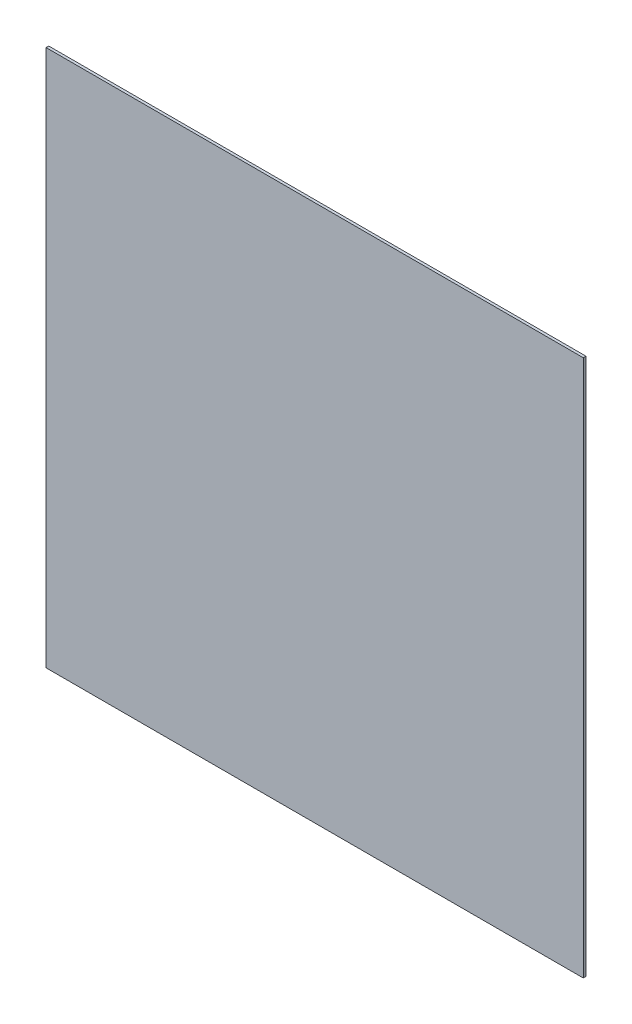
from build123d import *

# Parameters (mm, degrees)
KUTU_KAPAK_320X320_DIK_1_START = -320
SKETCH1_W                      = 320
SKETCH1_H                      = 320
KUTU_KAPAK_320X320_DIK_1_DEPTH = 1.6


with BuildPart() as part:
    # Sketch1 → KUTU_kapak_320x320_dik_1 (new body)
    with BuildSketch(Plane.XY.offset(KUTU_KAPAK_320X320_DIK_1_START)):
        with Locations((160, 201.6)):
            Rectangle(SKETCH1_W, SKETCH1_H)
    extrude(amount=-KUTU_KAPAK_320X320_DIK_1_DEPTH)


solid = part.part
